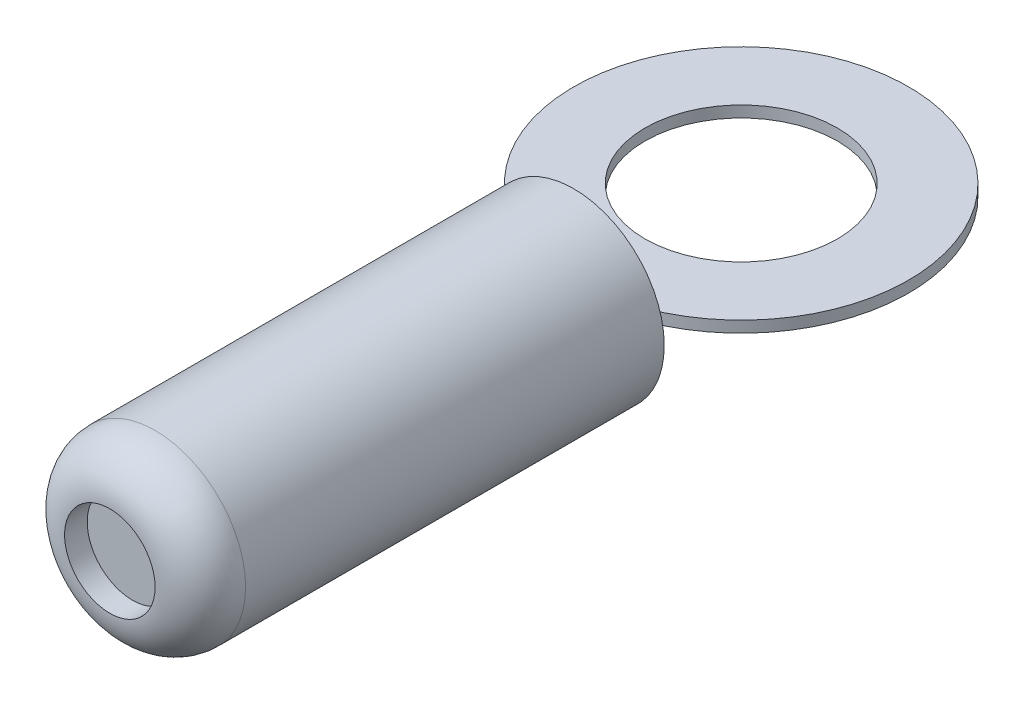
from build123d import *

# Parameters (mm, degrees)
SKETCH_8_R          = 4
EXTRUDE_4_DEPTH     = 20.5
SKETCH_10_R         = 7.4
SKETCH_10_R_2       = 4.25
EXTRUDE_5_DEPTH     = 0.5
FILLET_1_R          = 2
SKETCH_11_R         = 2
CUT_EXTRUDE_1_DEPTH = 1


with BuildPart() as part:
    # ｽｹｯﾁ8 → ﾎﾞｽ - 押し出し4 (new body)
    with BuildSketch(Plane.XY):
        Circle(SKETCH_8_R)
    extrude(amount=EXTRUDE_4_DEPTH)

    # ﾌｨﾚｯﾄ1
    fillet_1_edges = [part.edges().sort_by_distance(p)[0] for p in [
        (-4, 0, 20.5),
    ]]
    fillet(fillet_1_edges, radius=FILLET_1_R)

    # ｽｹｯﾁ11 → ｶｯﾄ - 押し出し1 (cut)
    with BuildSketch(Plane.XY.offset(20.5)):
        Circle(SKETCH_11_R)
    extrude(amount=-CUT_EXTRUDE_1_DEPTH, mode=Mode.SUBTRACT)


with BuildPart() as body_2:
    # ｽｹｯﾁ10 → ﾎﾞｽ - 押し出し5 (new body)
    with BuildSketch(Plane(origin=(0, 0, 0), x_dir=(1, 0, 0), z_dir=(0, 1, 0))):
        with Locations(Location((0, 7.4, 0), (0, 0, 270))):
            Circle(SKETCH_10_R)
        with Locations(Location((0, 7.4, 0), (0, 0, 270))):
            Circle(SKETCH_10_R_2, mode=Mode.SUBTRACT)
    extrude(amount=EXTRUDE_5_DEPTH)


solid = Compound([part.part, body_2.part])
